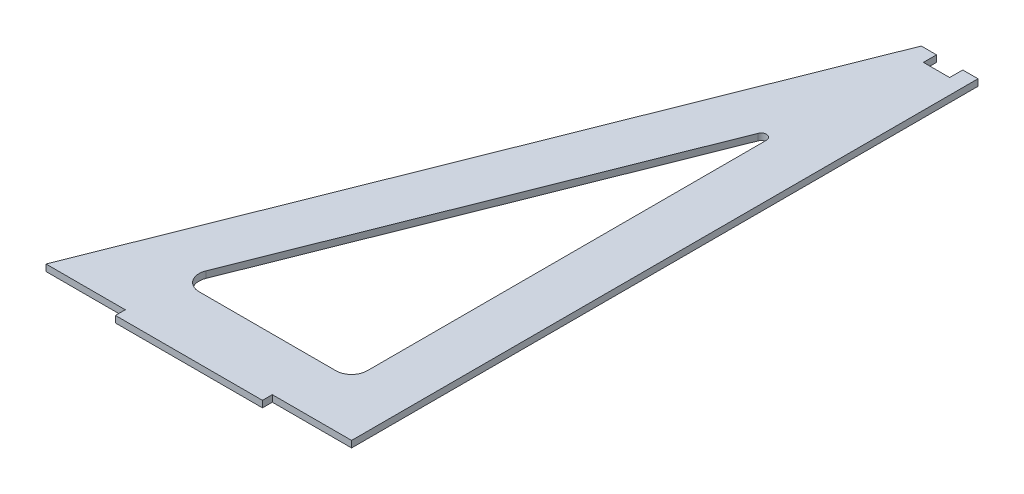
from build123d import *

# Parameters (mm, degrees)
BOSS_EXTRUDE1_DEPTH = 3.175
SKETCH2_W           = 12.7
SKETCH2_H           = 6.35
CUT_EXTRUDE1_DEPTH  = 3.175
FILLET1_R           = 7.62
FILLET2_R           = 2.54
SKETCH3_W           = 71.12
SKETCH3_H           = 3.175
BOSS_EXTRUDE2_DEPTH = 4.7625


with BuildPart() as part:
    # Sketch1 → Boss-Extrude1 (new body)
    with BuildSketch(Plane(origin=(0, 0, 0), x_dir=(1, 0, 0), z_dir=(0, 1, 0))):
        Polygon((0, 0), (-147.828, 0), (-27.432, 303.022), (0, 303.022), align=None)
    extrude(amount=BOSS_EXTRUDE1_DEPTH)

    # Sketch2 → Cut-Extrude1 (cut)
    with BuildSketch(Plane(origin=(0, 3.175, 0), x_dir=(1, 0, 0), z_dir=(0, 1, 0))):
        with Locations((-13.716, 299.847)):
            Rectangle(SKETCH2_W, SKETCH2_H)
        Polygon((-25.4, 25.4), (-25.4, 239.346487548), (-110.404723468, 25.4), align=None)
    extrude(amount=-CUT_EXTRUDE1_DEPTH, mode=Mode.SUBTRACT)

    # Fillet1
    fillet1_edges = [part.edges().sort_by_distance(p)[0] for p in [
        (-25.4, 1.5875, -25.4),
        (-110.404723468, 1.5875, -25.4),
    ]]
    fillet(fillet1_edges, radius=FILLET1_R)

    # Fillet2
    fillet2_edges = [part.edges().sort_by_distance(p)[0] for p in [
        (-25.4, 1.5875, -239.346487548),
    ]]
    fillet(fillet2_edges, radius=FILLET2_R)

    # Sketch3 → Boss-Extrude2 (add)
    with BuildSketch(Plane.XY):
        with Locations((-73.914, 1.5875)):
            Rectangle(SKETCH3_W, SKETCH3_H)
    extrude(amount=BOSS_EXTRUDE2_DEPTH)


solid = part.part
